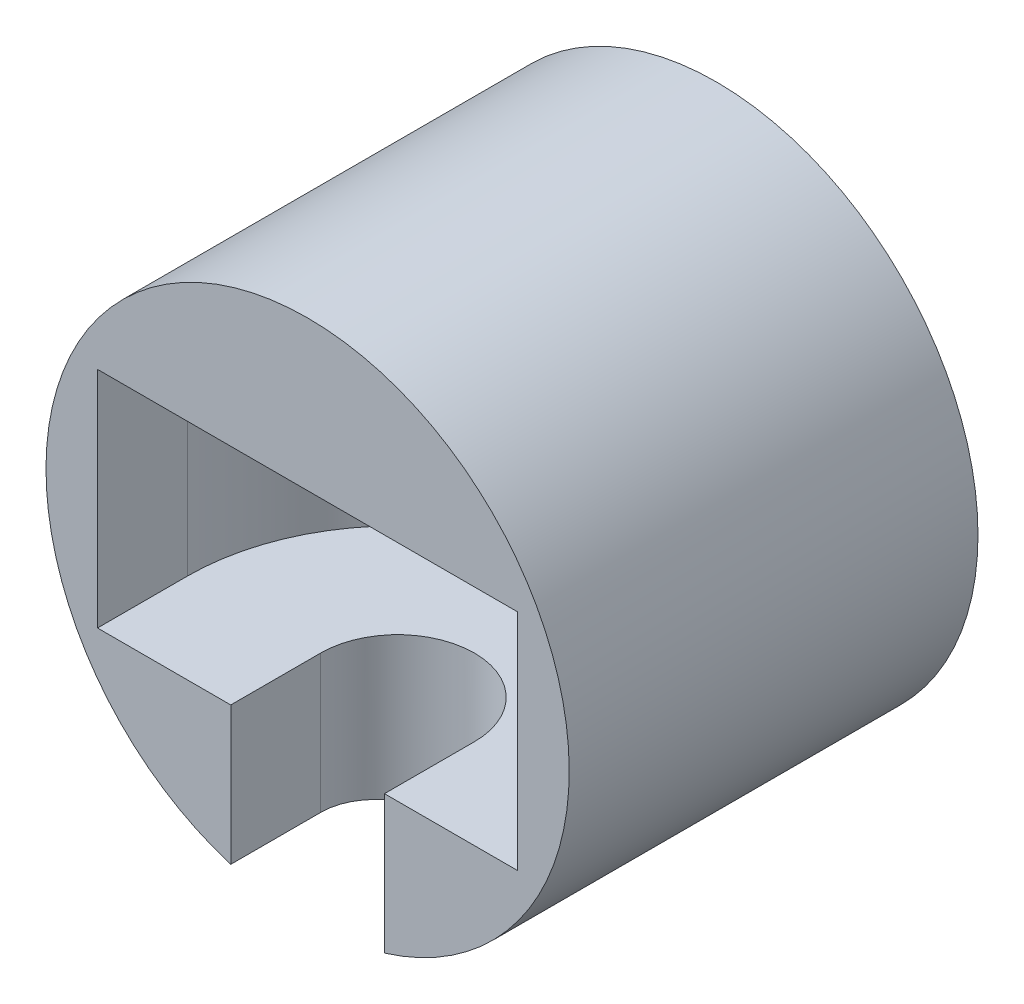
from build123d import *

# Parameters (mm, degrees)
SKETCH1_R               = 16
SKETCH1_R_2             = 3
BOSS_EXTRUDE1_DEPTH     = 25
CUT_EXTRUDE1_DEPTH      = 6.85
CUT_EXTRUDE2_REACH      = 35.719
CUT_EXTRUDE2_END_RADIUS = 16


with BuildPart() as part:
    # Sketch1 → Boss-Extrude1 (new body)
    with BuildSketch(Plane.XY):
        Circle(SKETCH1_R)
        Circle(SKETCH1_R_2, mode=Mode.SUBTRACT)
    extrude(amount=BOSS_EXTRUDE1_DEPTH)

    # Sketch2 → Cut-Extrude1 (cut, symmetric)
    with BuildSketch(Plane(origin=(0, 0, 0), x_dir=(1, 0, 0), z_dir=(0, 1, 0))):
        with BuildLine():
            Line((-12.85, -25), (-12.85, -19.5))
            ThreePointArc((-12.85, -19.5), (0, -6.65), (12.85, -19.5))
            Line((12.85, -19.5), (12.85, -25))
            Line((12.85, -25), (-12.85, -25))
        make_face()
    extrude(amount=CUT_EXTRUDE1_DEPTH, both=True, mode=Mode.SUBTRACT)

    # Cut-Extrude2: up to this cylinder (the profile starts inside it)
    cut_extrude2_end = Plane(origin=(0, 0, 20.344451), z_dir=(0, 0, -1)) * Cylinder(CUT_EXTRUDE2_END_RADIUS, 104.438, mode=Mode.PRIVATE)
    # Sketch3 → Cut-Extrude2 (cut, up to the surface)
    with BuildSketch(Plane(origin=(0, 0, 0), x_dir=(1, 0, 0), z_dir=(0, 1, 0)), mode=Mode.PRIVATE) as cut_extrude2_sk1:
        with BuildLine():
            Line((-4.7, -19.5), (-4.7, -25))
            Line((-4.7, -25), (4.7, -25))
            Line((4.7, -25), (4.7, -19.5))
            ThreePointArc((4.7, -19.5), (0, -14.8), (-4.7, -19.5))
        make_face()
    cut_extrude2_tool1 = extrude(cut_extrude2_sk1.sketch, amount=-CUT_EXTRUDE2_REACH, mode=Mode.PRIVATE) & cut_extrude2_end
    add(cut_extrude2_tool1.solids().sort_by_distance((0, 0, 20.344451))[0], mode=Mode.SUBTRACT)


solid = part.part
